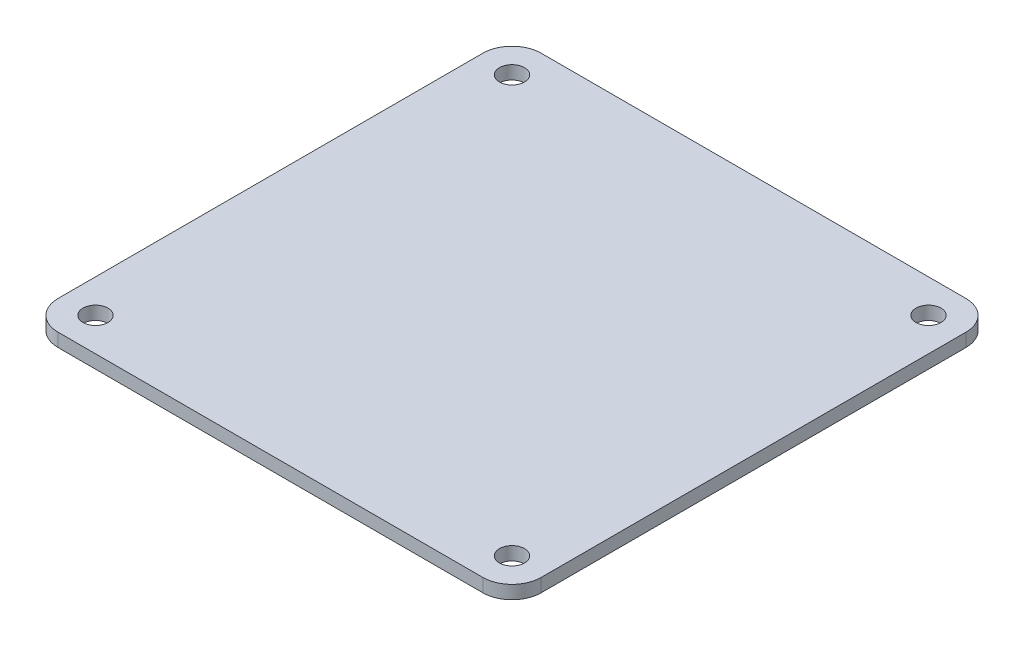
from build123d import *

# Parameters (mm, degrees)
SKETCH2_W           = 58
SKETCH2_H           = 58
SKETCH2_R           = 1.5
BOSS_EXTRUDE1_DEPTH = 1.6
FILLET1_R           = 3.5


with BuildPart() as part:
    # Sketch2 → Boss-Extrude1 (new body)
    with BuildSketch(Plane(origin=(0, 0, 0), x_dir=(1, 0, 0), z_dir=(0, 1, 0))):
        Rectangle(SKETCH2_W, SKETCH2_H)
        with Locations(Location((-25, 25, 0), (0, 0, 270))):
            Circle(SKETCH2_R, mode=Mode.SUBTRACT)
        with Locations(Location((25, 25, 0), (0, 0, 90))):
            Circle(SKETCH2_R, mode=Mode.SUBTRACT)
        with Locations(Location((25, -25, 0), (0, 0, 270))):
            Circle(SKETCH2_R, mode=Mode.SUBTRACT)
        with Locations(Location((-25, -25, 0), (0, 0, 90))):
            Circle(SKETCH2_R, mode=Mode.SUBTRACT)
    extrude(amount=BOSS_EXTRUDE1_DEPTH)

    # Fillet1
    fillet1_edges = [part.edges().sort_by_distance(p)[0] for p in [
        (-29, 0.8, -29),
        (29, 0.8, -29),
        (29, 0.8, 29),
        (-29, 0.8, 29),
    ]]
    fillet(fillet1_edges, radius=FILLET1_R)


solid = part.part
